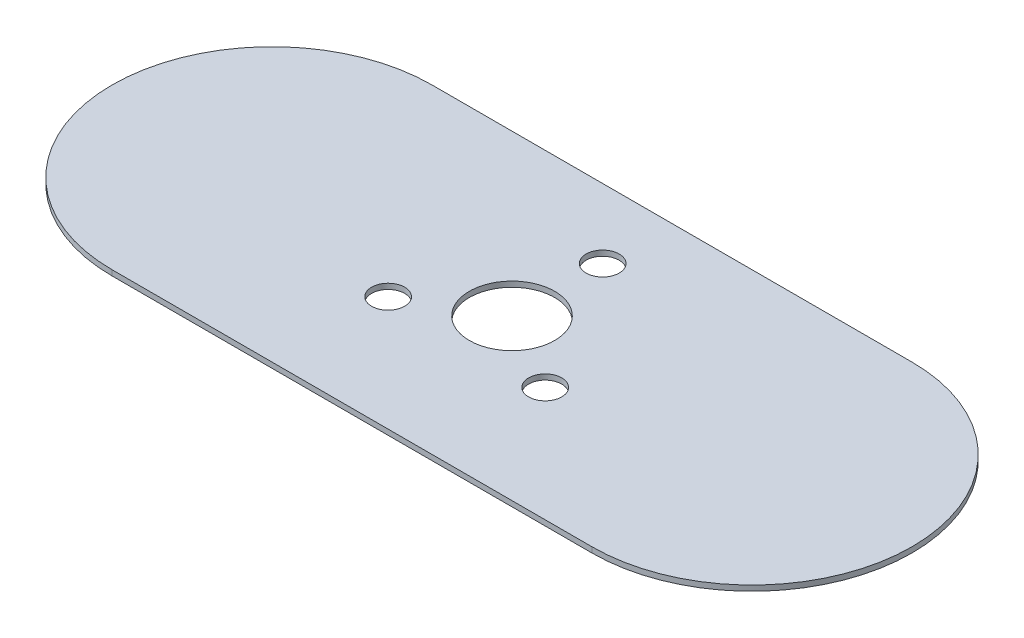
from build123d import *

# Parameters (mm, degrees)
BOSS_EXTRUDE1_DEPTH = 0.508
SKETCH2_R           = 1.55
SKETCH2_R_2         = 4
CUT_EXTRUDE1_DEPTH  = 1.6


with BuildPart() as part:
    # Sketch1 → Boss-Extrude1 (new body)
    with BuildSketch(Plane(origin=(0, 0, 0), x_dir=(1, 0, 0), z_dir=(0, 1, 0))):
        with BuildLine():
            Line((-22.5, 15), (22.5, 15))
            ThreePointArc((22.5, 15), (37.5, 0), (22.5, -15))
            Line((22.5, -15), (-22.5, -15))
            ThreePointArc((-22.5, -15), (-37.5, 0), (-22.5, 15))
        make_face()
    extrude(amount=BOSS_EXTRUDE1_DEPTH)

    # Sketch2 → Cut-Extrude1 (cut)
    with BuildSketch(Plane(origin=(0, 0.508, 0), x_dir=(1, 0, 0), z_dir=(0, 1, 0))):
        with Locations(Location((0, 8.5, 0), (0, 0, 270))):
            Circle(SKETCH2_R)
        with Locations(Location((7.361215932, -4.25, 0), (0, 0, 270))):
            Circle(SKETCH2_R)
        with Locations(Location((-7.361215932, -4.25, 0), (0, 0, 270))):
            Circle(SKETCH2_R)
        with Locations(Location((0, 0, 0), (0, 0, 270))):
            Circle(SKETCH2_R_2)
    extrude(amount=-CUT_EXTRUDE1_DEPTH, mode=Mode.SUBTRACT)


solid = part.part
